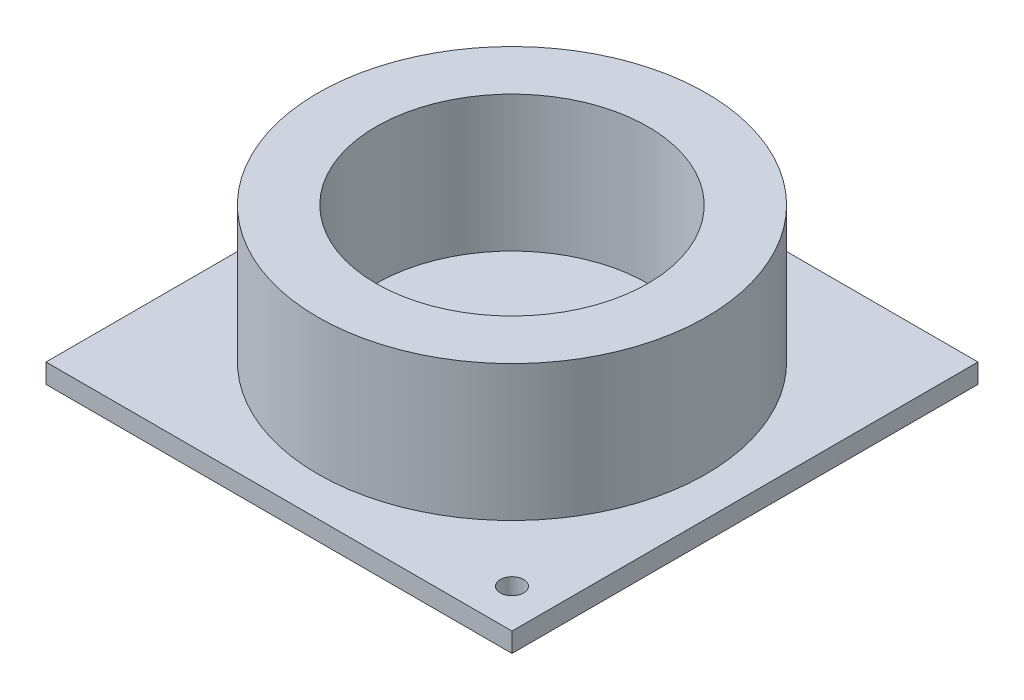
from build123d import *

# Parameters (mm, degrees)
SKETCH1_R           = 50
SKETCH1_R_2         = 35
BOSS_EXTRUDE1_DEPTH = 40
SKETCH2_W           = 120
SKETCH2_H           = 120
BOSS_EXTRUDE2_DEPTH = 5
SKETCH3_R           = 3
CUT_EXTRUDE1_DEPTH  = 5


with BuildPart() as part:
    # Sketch1 → Boss-Extrude1 (new body)
    with BuildSketch(Plane(origin=(0, 0, 0), x_dir=(1, 0, 0), z_dir=(0, 1, 0))):
        with Locations(Location((0, 0, 0), (0, 0, 270))):
            Circle(SKETCH1_R)
        with Locations(Location((0, 0, 0), (0, 0, 270))):
            Circle(SKETCH1_R_2, mode=Mode.SUBTRACT)
    extrude(amount=BOSS_EXTRUDE1_DEPTH)

    # Sketch2 → Boss-Extrude2 (add)
    with BuildSketch(Plane(origin=(0, 0, 0), x_dir=(1, 0, 0), z_dir=(0, 1, 0))):
        Rectangle(SKETCH2_W, SKETCH2_H)
    extrude(amount=BOSS_EXTRUDE2_DEPTH)

    # Sketch3 → Cut-Extrude1 (cut)
    with BuildSketch(Plane(origin=(0, 5, 0), x_dir=(1, 0, 0), z_dir=(0, 1, 0))):
        with Locations(Location((-50, 50, 0), (0, 0, 270))):
            Circle(SKETCH3_R)
        with Locations(Location((50, -50, 0), (0, 0, 270))):
            Circle(SKETCH3_R)
    extrude(amount=-CUT_EXTRUDE1_DEPTH, mode=Mode.SUBTRACT)


solid = part.part
